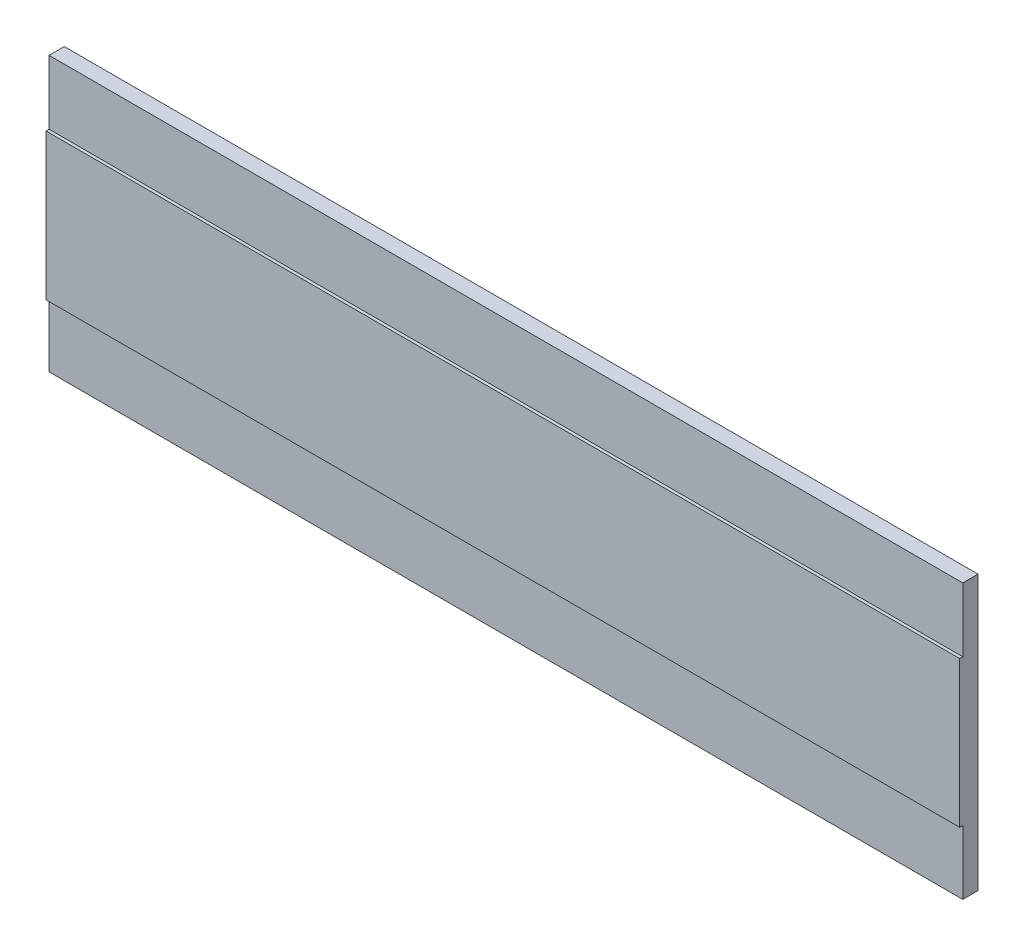
from build123d import *

# Parameters (mm, degrees)
SZKIC1_W                    = 600
SZKIC1_H                    = 180
DODANIE_WYCI_GNI_CIE1_DEPTH = 10
SZKIC2_W                    = 600
SZKIC2_H                    = 96
DODANIE_WYCI_GNI_CIE2_DEPTH = 2


with BuildPart() as part:
    # Szkic1 → Dodanie-wyciągnięcie1 (new body)
    with BuildSketch(Plane.XY):
        with Locations((300, 360)):
            Rectangle(SZKIC1_W, SZKIC1_H)
    extrude(amount=DODANIE_WYCI_GNI_CIE1_DEPTH)

    # Szkic2 → Dodanie-wyciągnięcie2 (add)
    with BuildSketch(Plane.XY.offset(10)):
        with Locations((300, 360)):
            Rectangle(SZKIC2_W, SZKIC2_H)
    extrude(amount=DODANIE_WYCI_GNI_CIE2_DEPTH)


solid = part.part
